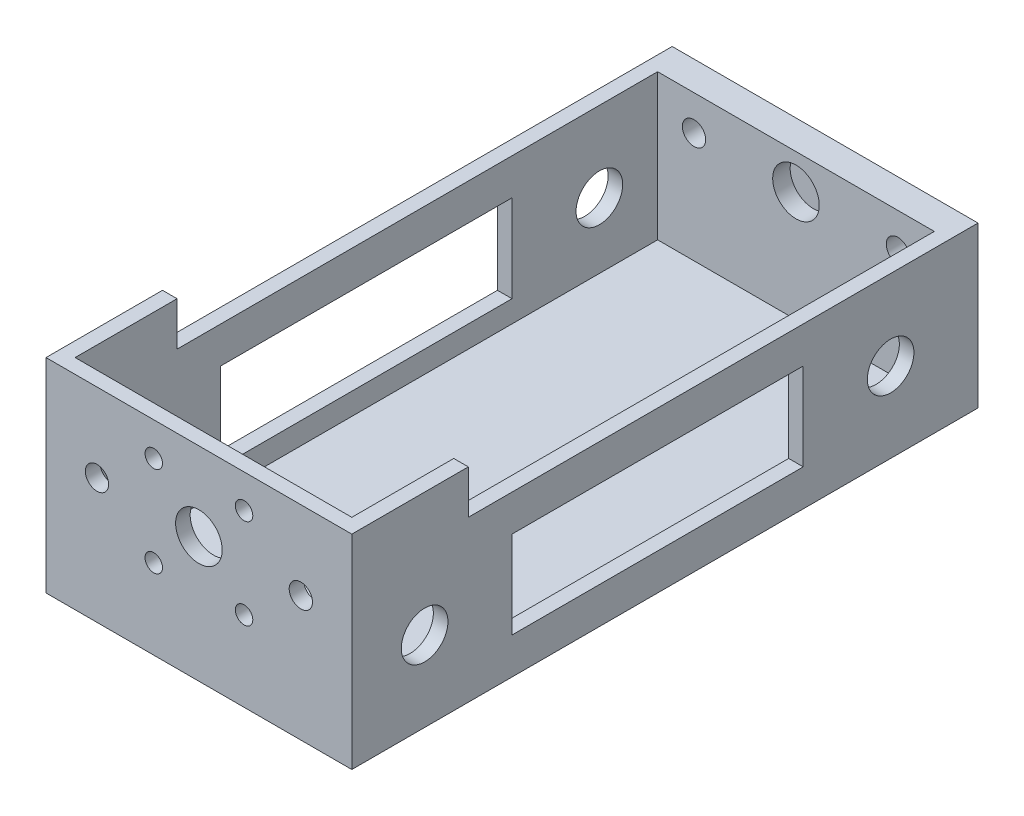
from build123d import *

# Parameters (mm, degrees)
SKETCH1_W           = 100
SKETCH1_H           = 200
BOSS_EXTRUDE1_DEPTH = 2.5
SKETCH2_W           = 200
SKETCH2_H           = 70
BOSS_EXTRUDE2_DEPTH = 2.5
SKETCH3_R           = 8
CUT_EXTRUDE1_DEPTH  = 5
SKETCH4_W           = 105
SKETCH4_H           = 70
BOSS_EXTRUDE3_DEPTH = 10
SKETCH5_W           = 105
SKETCH5_H           = 70
BOSS_EXTRUDE4_DEPTH = 5
SKETCH6_W           = 100
SKETCH6_H           = 30
CUT_EXTRUDE2_DEPTH  = 167.37683132
SKETCH7_R           = 4
CUT_EXTRUDE5_DEPTH  = 232.381719243
SKETCH7_5_R         = 3
SKETCH7_5_R_2       = 8
CUT_EXTRUDE6_DEPTH  = 5
SKETCH8_R           = 8
CUT_EXTRUDE7_DEPTH  = 6
SKETCH9_W           = 105
SKETCH9_H           = 175
CUT_EXTRUDE8_DEPTH  = 15


with BuildPart() as part:
    # Sketch1 → Boss-Extrude1 (new, symmetric)
    with BuildSketch(Plane(origin=(0, 0, 0), x_dir=(1, 0, 0), z_dir=(0, 1, 0))):
        Rectangle(SKETCH1_W, SKETCH1_H)
    extrude(amount=BOSS_EXTRUDE1_DEPTH, both=True)

    # Sketch2 → Boss-Extrude2 (add, symmetric)
    with BuildSketch(Plane.ZY.offset(50)):
        with Locations((0, 32.5)):
            Rectangle(SKETCH2_W, SKETCH2_H)
    boss_extrude2 = extrude(amount=BOSS_EXTRUDE2_DEPTH, both=True)

    # Sketch3 → Cut-Extrude1 (cut)
    with BuildSketch(Plane.ZY.offset(52.5)):
        with Locations((-80, 25)):
            Circle(SKETCH3_R)
        with Locations((80, 25)):
            Circle(SKETCH3_R)
    cut_extrude1 = extrude(amount=-CUT_EXTRUDE1_DEPTH, mode=Mode.SUBTRACT)

    # Mirror1: Boss-Extrude2, Cut-Extrude1 across plane
    add(boss_extrude2.mirror(Plane(origin=(0, 0, 0), x_dir=(0, 0, 1), z_dir=(1, 0, 0))))
    add(cut_extrude1.mirror(Plane(origin=(0, 0, 0), x_dir=(0, 0, 1), z_dir=(1, 0, 0))), mode=Mode.SUBTRACT)

    # Sketch4 → Boss-Extrude3 (add)
    with BuildSketch(Plane(origin=(0, 0, -100), x_dir=(-1, 0, 0), z_dir=(0, 0, -1))):
        with Locations((0, 32.5)):
            Rectangle(SKETCH4_W, SKETCH4_H)
    extrude(amount=BOSS_EXTRUDE3_DEPTH)

    # Sketch5 → Boss-Extrude4 (add)
    with BuildSketch(Plane.XY.offset(100)):
        with Locations((0, 32.5)):
            Rectangle(SKETCH5_W, SKETCH5_H)
    extrude(amount=BOSS_EXTRUDE4_DEPTH)

    # Sketch6 → Cut-Extrude2 (cut, through all)
    with BuildSketch(Plane.ZY.offset(52.5)):
        with Locations((0, 25)):
            Rectangle(SKETCH6_W, SKETCH6_H)
    extrude(amount=-CUT_EXTRUDE2_DEPTH, mode=Mode.SUBTRACT)

    # Sketch7 → Cut-Extrude5 (cut, through all)
    with BuildSketch(Plane(origin=(0, 0, 105), x_dir=(-1, 0, 0), z_dir=(0, 0, -1))):
        with Locations(Location((35, 40.5, 0), (0, 0, 180))):
            Circle(SKETCH7_R)
        with Locations(Location((-35, 40.5, 0), (0, 0, 180))):
            Circle(SKETCH7_R)
    extrude(amount=CUT_EXTRUDE5_DEPTH, mode=Mode.SUBTRACT)

    # Sketch7<5> → Cut-Extrude6 (cut)
    with BuildSketch(Plane(origin=(0, 0, 105), x_dir=(-1, 0, 0), z_dir=(0, 0, -1))):
        with Locations(Location((15.5, 56, 0), (0, 0, 180))):
            Circle(SKETCH7_5_R)
        with Locations(Location((-15.5, 56, 0), (0, 0, 180))):
            Circle(SKETCH7_5_R)
        with Locations(Location((15.5, 25, 0), (0, 0, 180))):
            Circle(SKETCH7_5_R)
        with Locations(Location((-15.5, 25, 0), (0, 0, 180))):
            Circle(SKETCH7_5_R)
        with Locations(Location((0, 40.5, 0), (0, 0, 180))):
            Circle(SKETCH7_5_R_2)
    extrude(amount=CUT_EXTRUDE6_DEPTH, mode=Mode.SUBTRACT)

    # Sketch8 → Cut-Extrude7 (cut)
    with BuildSketch(Plane(origin=(0, 0, -100), x_dir=(-1, 0, 0), z_dir=(0, 0, -1))):
        with Locations(Location((0, 40.5, 0), (0, 0, 180))):
            Circle(SKETCH8_R)
    extrude(amount=CUT_EXTRUDE7_DEPTH, mode=Mode.SUBTRACT)

    # Sketch9 → Cut-Extrude8 (cut)
    with BuildSketch(Plane(origin=(0, 67.5, 0), x_dir=(1, 0, 0), z_dir=(0, 1, 0))):
        with Locations((0, 22.5)):
            Rectangle(SKETCH9_W, SKETCH9_H)
    extrude(amount=-CUT_EXTRUDE8_DEPTH, mode=Mode.SUBTRACT)


solid = part.part
